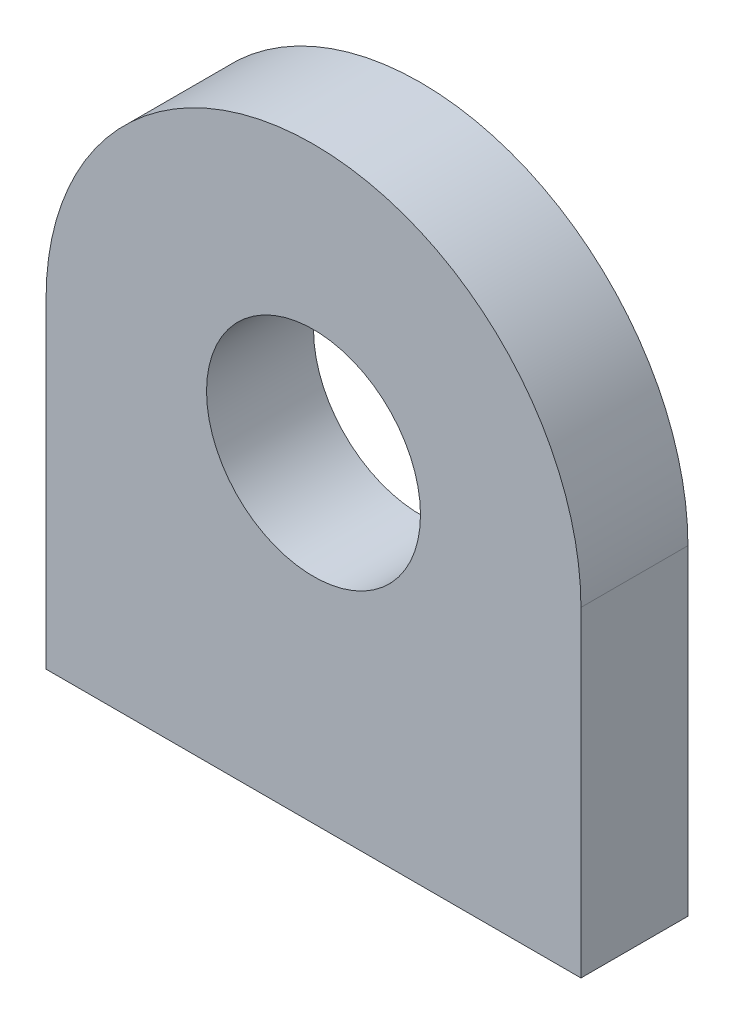
from build123d import *

# Parameters (mm, degrees)
BOSS_EXTRUDE1_DEPTH = 10
SKETCH2_R           = 10
CUT_EXTRUDE1_DEPTH  = 10


with BuildPart() as part:
    # Sketch1 → Boss-Extrude1 (new body)
    with BuildSketch(Plane.XY):
        with BuildLine():
            Line((-25, 0), (-25, -30))
            Line((-25, -30), (25, -30))
            Line((25, -30), (25, 0))
            ThreePointArc((25, 0), (0, 25), (-25, 0))
        make_face()
    extrude(amount=BOSS_EXTRUDE1_DEPTH)

    # Sketch2 → Cut-Extrude1 (cut)
    with BuildSketch(Plane.XY.offset(10)):
        Circle(SKETCH2_R)
    extrude(amount=-CUT_EXTRUDE1_DEPTH, mode=Mode.SUBTRACT)


solid = part.part
